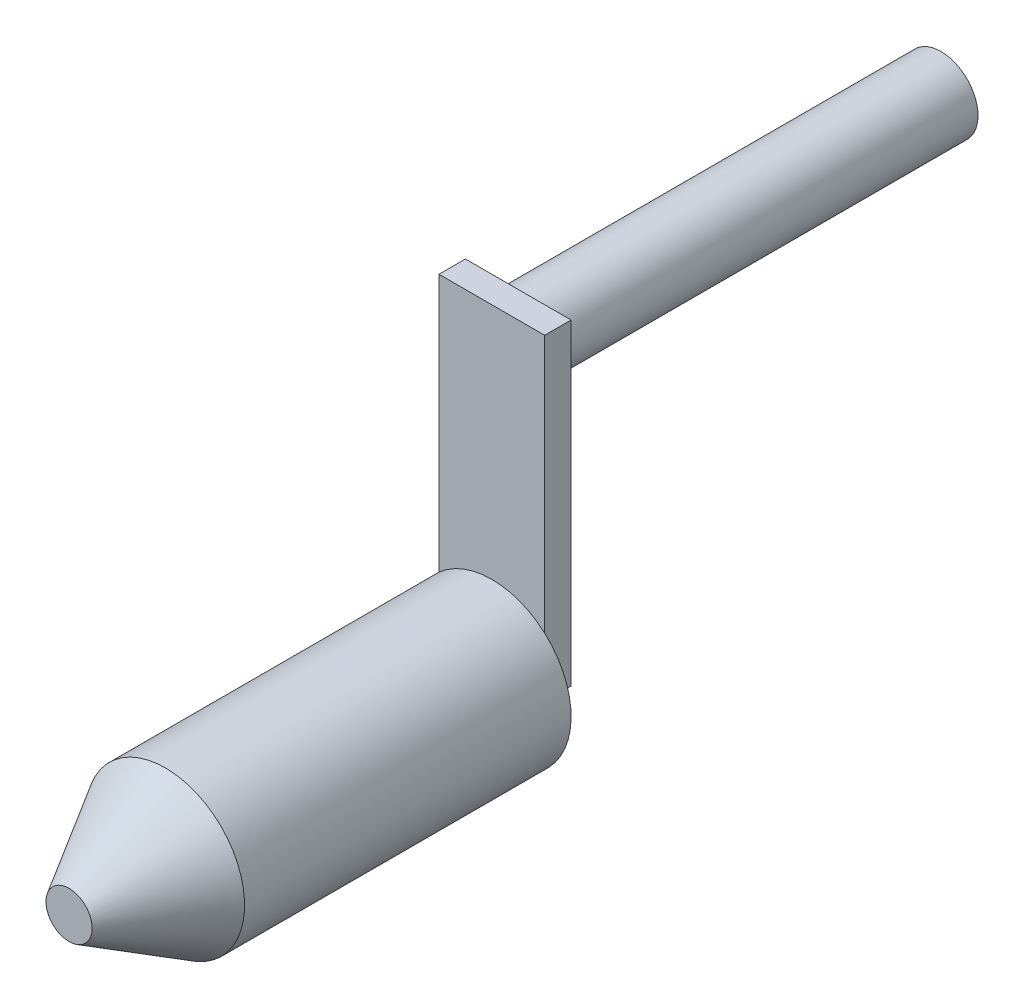
from build123d import *

# Parameters (mm, degrees)
SKETCH1_R           = 9.525
BOSS_EXTRUDE1_DEPTH = 50.8
SKETCH2_W           = 12.7
SKETCH2_H           = 38.1
BOSS_EXTRUDE2_DEPTH = 3.175
SKETCH3_R           = 4.445
BOSS_EXTRUDE3_DEPTH = 50.8


with BuildPart() as part:
    # Sketch1 → Boss-Extrude1 (new body)
    with BuildSketch(Plane.XY):
        Circle(SKETCH1_R)
    extrude(amount=BOSS_EXTRUDE1_DEPTH)

    # Sketch2 → Boss-Extrude2 (add)
    with BuildSketch(Plane(origin=(0, 0, 0), x_dir=(-1, 0, 0), z_dir=(0, 0, -1))):
        with Locations((0, 19.05)):
            Rectangle(SKETCH2_W, SKETCH2_H)
    extrude(amount=BOSS_EXTRUDE2_DEPTH)

    # Sketch3 → Boss-Extrude3 (add)
    with BuildSketch(Plane(origin=(0, 0, -3.175), x_dir=(-1, 0, 0), z_dir=(0, 0, -1))):
        with Locations((0, 33.02)):
            Circle(SKETCH3_R)
    extrude(amount=BOSS_EXTRUDE3_DEPTH)

    # Sketch4 → Cut-Revolve1 (revolve, cut)
    with BuildSketch(Plane(origin=(0, 0, 0), x_dir=(0, 0, -1), z_dir=(1, 0, 0))):
        Polygon((-50.8, 2.77134643), (-39.232133446, 9.525), (-50.8, 9.525), align=None)
    revolve(axis=Axis((0, 0, -0.789350743), (0, 0, 1)), mode=Mode.SUBTRACT)


solid = part.part
